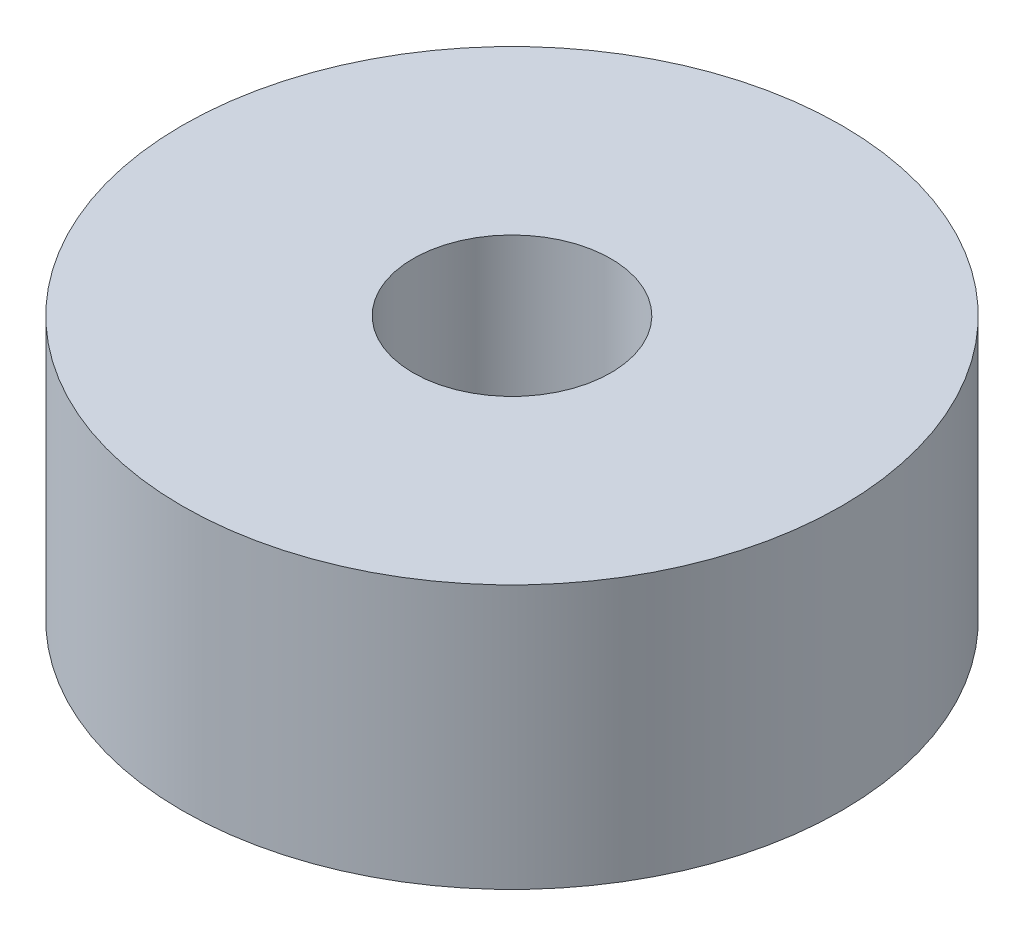
from build123d import *

# Parameters (mm, degrees)
CROQUIS1_R              = 5
CROQUIS1_R_2            = 1.5
SALIENTE_EXTRUIR1_DEPTH = 4


with BuildPart() as part:
    # Croquis1 → Saliente-Extruir1 (new body)
    with BuildSketch(Plane(origin=(0, 0, 0), x_dir=(1, 0, 0), z_dir=(0, 1, 0))):
        with Locations(Location((0, 0, 0), (0, 0, 270))):
            Circle(CROQUIS1_R)
        with Locations(Location((0, 0, 0), (0, 0, 270))):
            Circle(CROQUIS1_R_2, mode=Mode.SUBTRACT)
    extrude(amount=SALIENTE_EXTRUIR1_DEPTH)


solid = part.part
